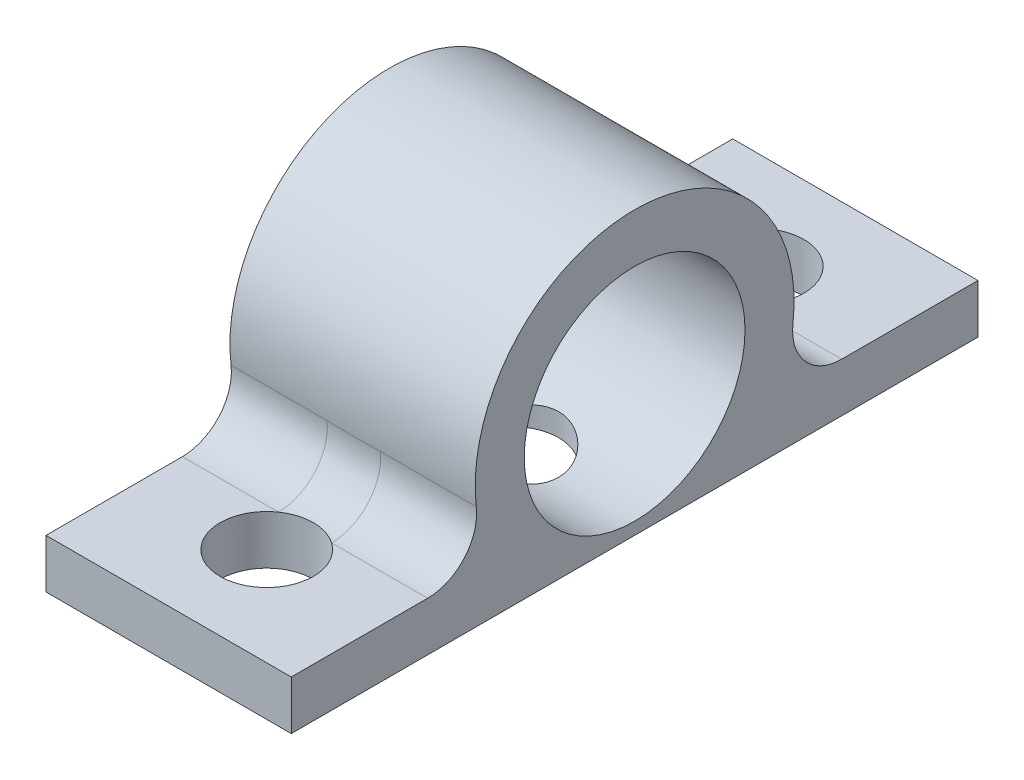
from build123d import *

# Parameters (mm, degrees)
SKETCH1_R           = 4.5
BOSS_EXTRUDE1_DEPTH = 10
SKETCH2_R           = 1.9
CUT_EXTRUDE1_DEPTH  = 10
FILLET1_R           = 2
SKETCH3_R           = 1.9
CUT_EXTRUDE2_DEPTH  = 5


with BuildPart() as part:
    # Sketch1 → Boss-Extrude1 (new body)
    with BuildSketch(Plane(origin=(0, 0, 0), x_dir=(0, 0, -1), z_dir=(1, 0, 0))):
        with BuildLine():
            Line((0, 0), (28, 0))
            Line((28, 0), (28, 2))
            Line((28, 2), (19.766281297, 2))
            ThreePointArc((19.766281297, 2), (14, 11.5), (8.233718703, 2))
            Line((8.233718703, 2), (0, 2))
            Line((0, 2), (0, 0))
        make_face()
        with Locations((14, 5)):
            Circle(SKETCH1_R, mode=Mode.SUBTRACT)
    extrude(amount=BOSS_EXTRUDE1_DEPTH)

    # Sketch2 → Cut-Extrude1 (cut)
    with BuildSketch(Plane(origin=(0, 2, 0), x_dir=(1, 0, 0), z_dir=(0, 1, 0))):
        with Locations(Location((5, 24, 0), (0, 0, 270))):
            Circle(SKETCH2_R)
        with Locations(Location((5, 4, 0), (0, 0, 270))):
            Circle(SKETCH2_R)
    extrude(amount=-CUT_EXTRUDE1_DEPTH, mode=Mode.SUBTRACT)

    # Fillet1
    fillet1_edges = [part.edges().sort_by_distance(p)[0] for p in [
        (5, 2, -8.233718703),
        (5, 2, -19.766281297),
    ]]
    fillet(fillet1_edges, radius=FILLET1_R)

    # Sketch3 → Cut-Extrude2 (cut)
    with BuildSketch(Plane.XZ):
        with Locations(Location((5, -14, 0), (0, 0, 270))):
            Circle(SKETCH3_R)
    extrude(amount=-CUT_EXTRUDE2_DEPTH, mode=Mode.SUBTRACT)


solid = part.part
